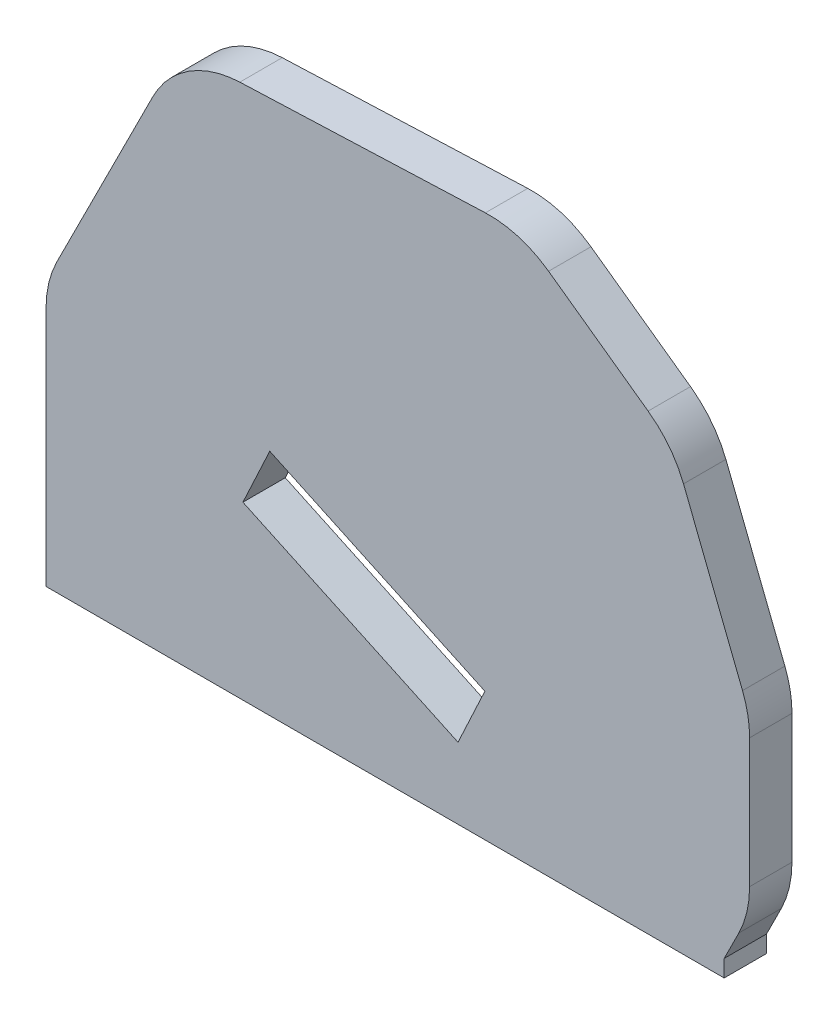
from build123d import *

# Parameters (mm, degrees)
BOSS_EXTRUDE1_DEPTH = 0.125
FILLET1_R           = 0.6


with BuildPart() as part:
    # frame_outline → Boss-Extrude1 (new, symmetric)
    with BuildSketch(Plane.XY):
        Polygon((0, 0), (4, 0), (4, 0.1), (4.15, 0.4), (4.15, 1.416096183), (3.695232724, 2.568743907), (2.797078859, 3.212298026), (0.789408464, 3.133982378), (0, 1.562826413), align=None)
        Polygon((1.161298437, 1.010989603), (2.430129339, 0.419324036), (2.588611187, 0.759189456), (1.319780285, 1.350855023), align=None, mode=Mode.SUBTRACT)
    extrude(amount=BOSS_EXTRUDE1_DEPTH, both=True)

    # Fillet1
    fillet1_edges = [part.edges().sort_by_distance(p)[0] for p in [
        (0, 1.562826413, 0),
        (0.789408464, 3.133982378, 0),
        (2.797078859, 3.212298026, 0),
        (3.695232724, 2.568743907, 0),
        (4.15, 1.416096183, 0),
        (4.15, 0.4, 0),
    ]]
    fillet(fillet1_edges, radius=FILLET1_R)


solid = part.part
